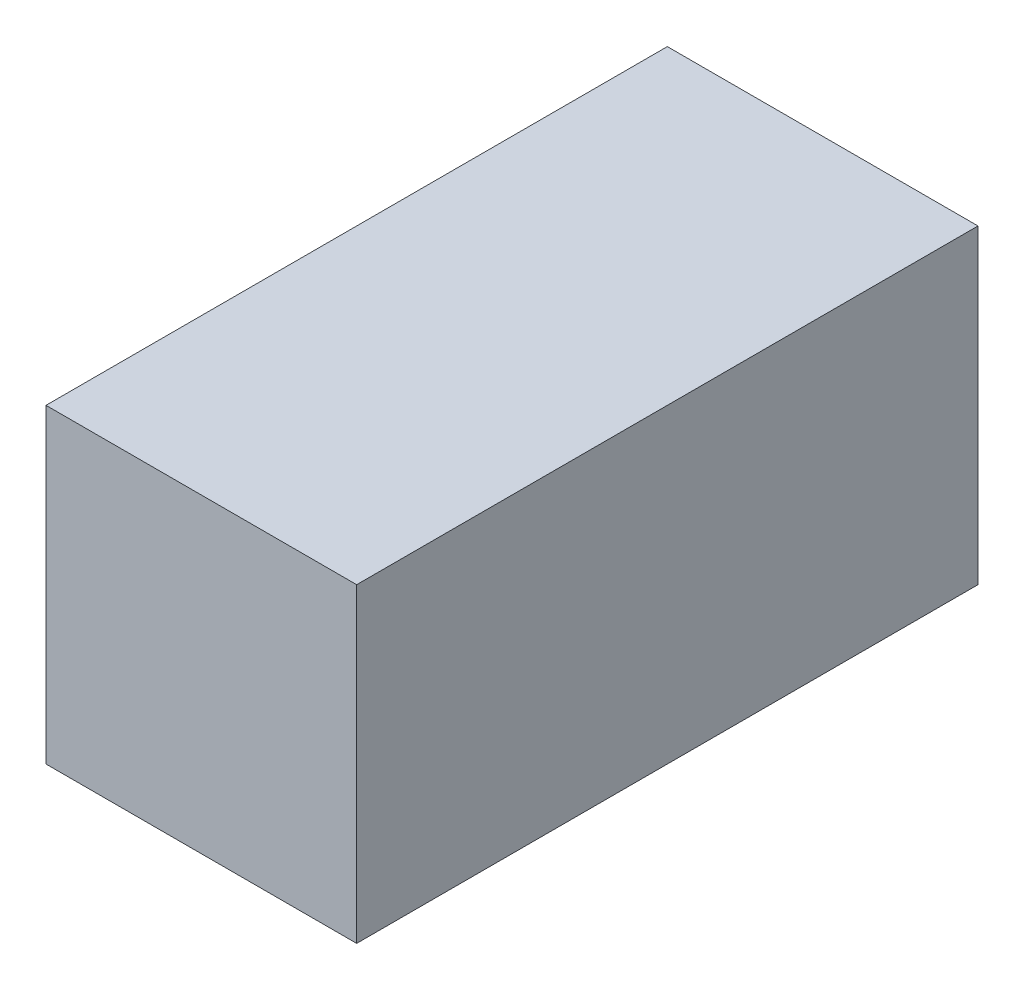
from build123d import *

# Parameters (mm, degrees)
SKETCH1_W           = 10
SKETCH1_H           = 20
BOSS_EXTRUDE1_DEPTH = 10
SKETCH2_R           = 2.5
CUT_EXTRUDE1_DEPTH  = 4


with BuildPart() as part:
    # Sketch1 → Boss-Extrude1 (new body)
    with BuildSketch(Plane(origin=(0, 0, 0), x_dir=(1, 0, 0), z_dir=(0, 1, 0))):
        Rectangle(SKETCH1_W, SKETCH1_H)
    extrude(amount=BOSS_EXTRUDE1_DEPTH)

    # Sketch2 → Cut-Extrude1 (cut)
    with BuildSketch(Plane(origin=(0, 0, -10), x_dir=(-1, 0, 0), z_dir=(0, 0, -1))):
        with Locations((0, 5)):
            Circle(SKETCH2_R)
    extrude(amount=-CUT_EXTRUDE1_DEPTH, mode=Mode.SUBTRACT)


solid = part.part
